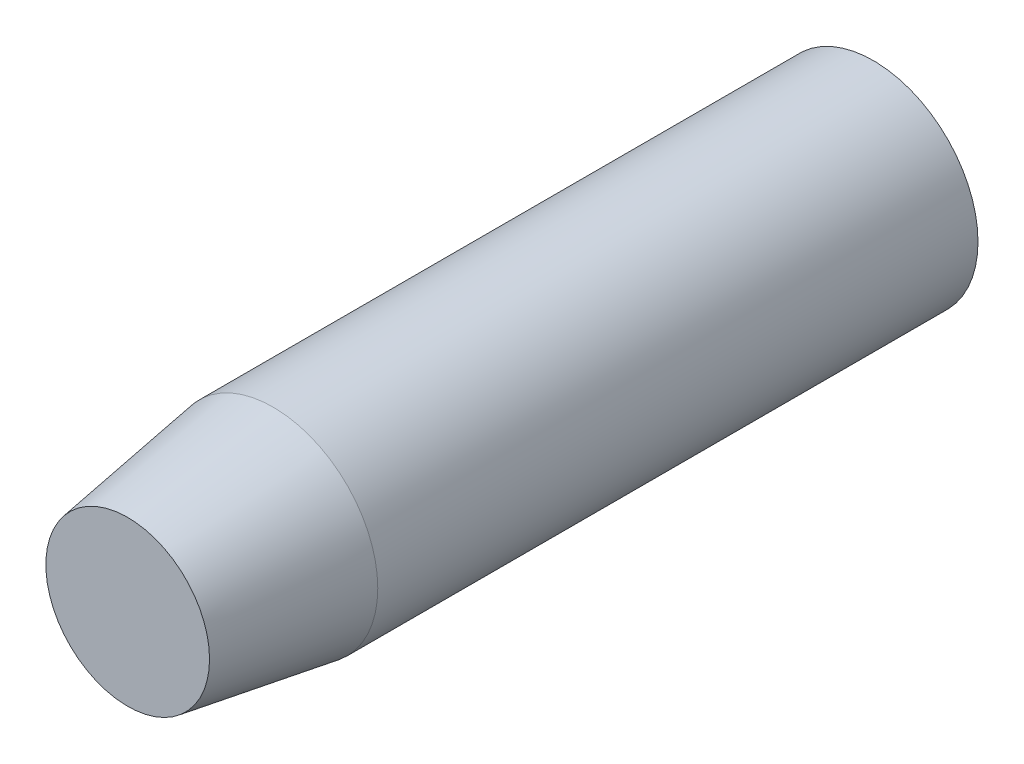
from build123d import *

# Parameters (mm, degrees)
SKETCH1_R           = 18.25625
BOSS_EXTRUDE1_DEPTH = 65.0875
CHAMFER1_SIZE       = 25.4
CHAMFER1_SIZE2      = 3.96875


with BuildPart() as part:
    # Sketch1 → Boss-Extrude1 (new, symmetric)
    with BuildSketch(Plane.XY):
        Circle(SKETCH1_R)
    extrude(amount=BOSS_EXTRUDE1_DEPTH, both=True)

    # Chamfer1
    chamfer1_edges = [part.edges().sort_by_distance(p)[0] for p in [
        (-18.25625, 0, 65.0875),
    ]]
    chamfer1_side = [part.faces().sort_by_distance(p)[0] for p in [
        (-18.25625, 0, 0),
    ]]
    chamfer(chamfer1_edges, length=CHAMFER1_SIZE, length2=CHAMFER1_SIZE2, reference=chamfer1_side[0])


solid = part.part
